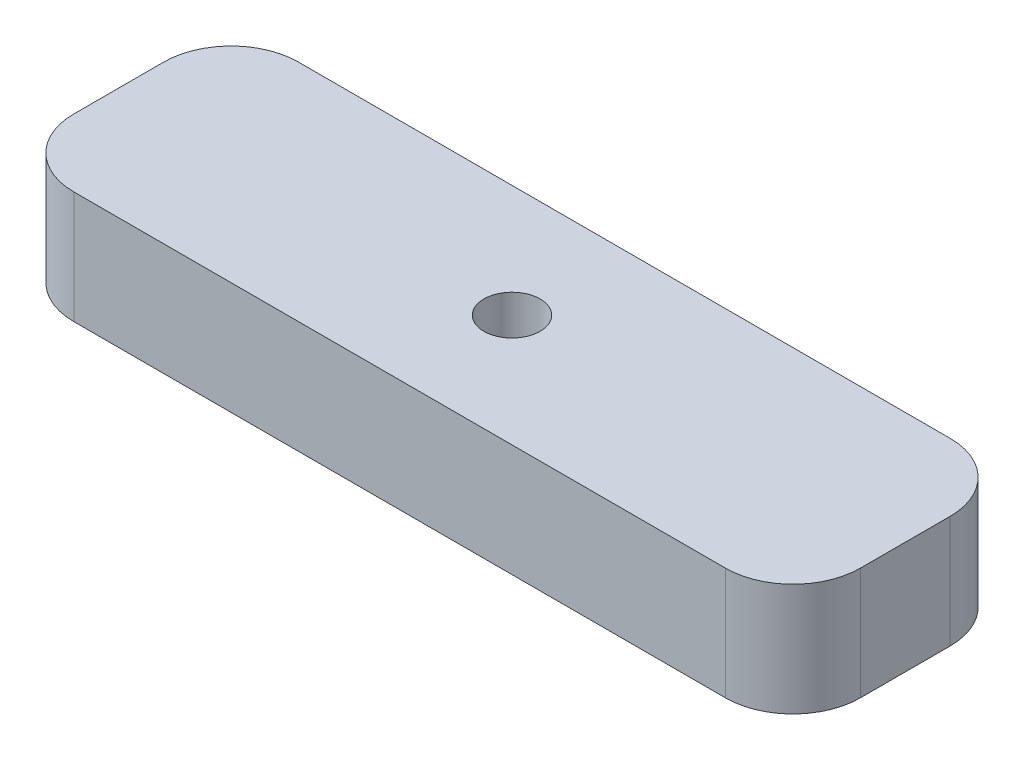
from build123d import *

# Parameters (mm, degrees)
SKETCH_1_W      = 35
SKETCH_1_H      = 10
SKETCH_1_R      = 1.25
EXTRUDE_1_DEPTH = 5
FILLET_1_R      = 3


with BuildPart() as part:
    # Эскиз1 → Бобышка-Вытянуть1 (new body)
    with BuildSketch(Plane(origin=(0, 0, 0), x_dir=(1, 0, 0), z_dir=(0, 1, 0))):
        Rectangle(SKETCH_1_W, SKETCH_1_H)
        with Locations(Location((0, 0, 0), (0, 0, 270))):
            Circle(SKETCH_1_R, mode=Mode.SUBTRACT)
    extrude(amount=EXTRUDE_1_DEPTH)

    # Скругление1
    fillet_1_edges = [part.edges().sort_by_distance(p)[0] for p in [
        (17.5, 2.5, 5),
        (-17.5, 2.5, 5),
        (-17.5, 2.5, -5),
        (17.5, 2.5, -5),
    ]]
    fillet(fillet_1_edges, radius=FILLET_1_R)


solid = part.part
